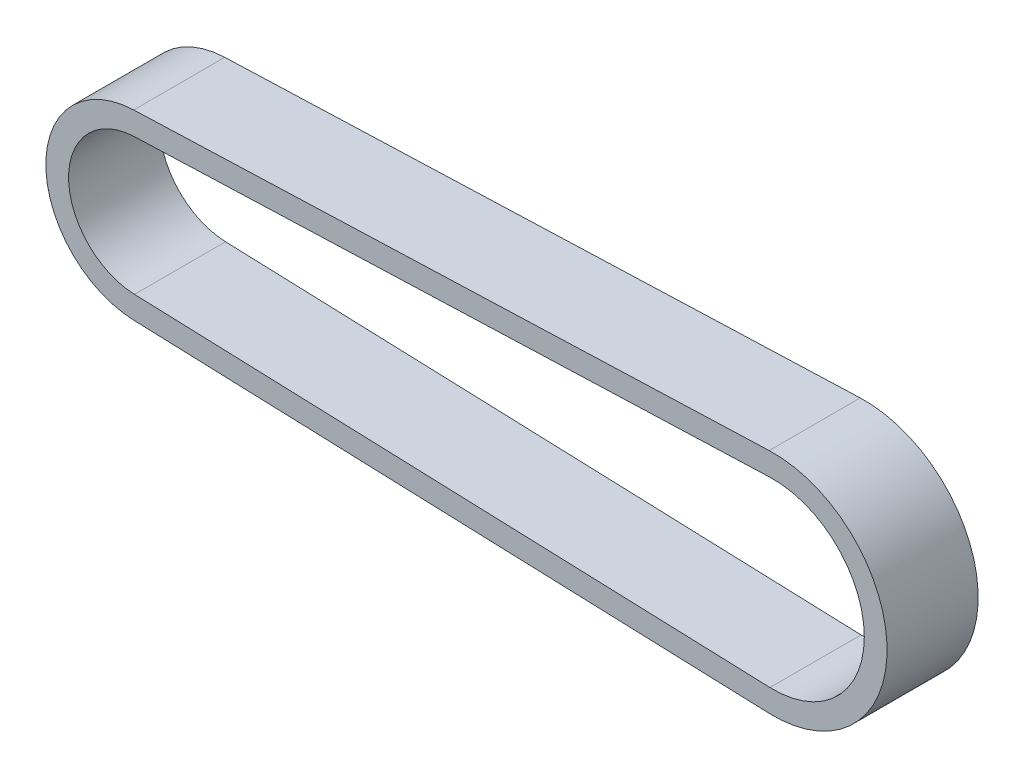
from build123d import *

# Parameters (mm, degrees)
EXTRUDE_THIN1_DEPTH = 3


with BuildPart() as part:
    # Sketch1 → Extrude-Thin1 (new, symmetric)
    with BuildSketch(Plane.XY):
        with BuildLine():
            Line((20.891862031, 1.748878717), (-20.963445708, 0.249839817))
            ThreePointArc((-20.963445708, 0.249839817), (-26.748694676, -5.746315785), (-20.963445708, -11.742471386))
            Line((-20.963445708, -11.742471386), (20.891862031, -13.241510286))
            ThreePointArc((20.891862031, -13.241510286), (28.66030082, -5.746315785), (20.891862031, 1.748878717))
        make_face()
        with BuildLine():
            Line((20.945549788, 0.249839817), (-20.90975795, -1.249199084))
            ThreePointArc((-20.90975795, -1.249199084), (-25.248694676, -5.746315785), (-20.90975795, -10.243432485))
            Line((-20.90975795, -10.243432485), (20.945549788, -11.742471386))
            ThreePointArc((20.945549788, -11.742471386), (27.16030082, -5.746315785), (20.945549788, 0.249839817))
        make_face(mode=Mode.SUBTRACT)
    extrude(amount=EXTRUDE_THIN1_DEPTH, both=True)


solid = part.part
